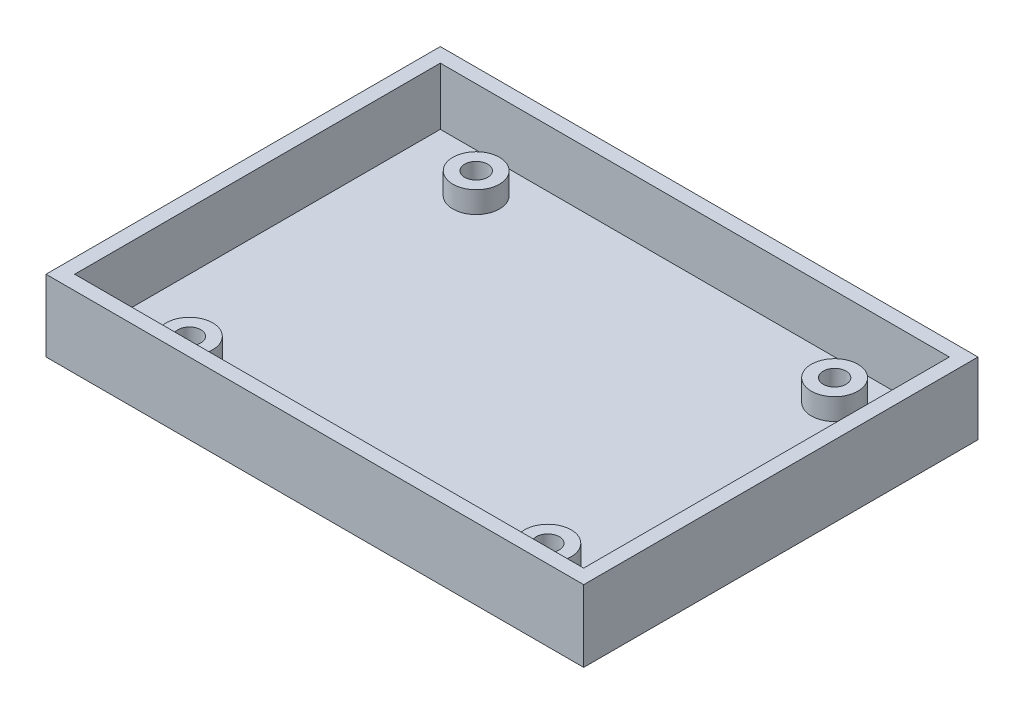
from build123d import *

# Parameters (mm, degrees)
SKETCH1_W             = 75
SKETCH1_H             = 55
BODY_DEPTH            = 10
SHELL1_T              = -2
SKETCH2_R             = 3.25
INSERTS_SUPPORT_DEPTH = 3
SKETCH3_R             = 1.6
INSERTS_HOLES_DEPTH   = 4


with BuildPart() as part:
    # Sketch1 → Body (new body)
    with BuildSketch(Plane(origin=(0, 0, 0), x_dir=(1, 0, 0), z_dir=(0, 1, 0))):
        Rectangle(SKETCH1_W, SKETCH1_H)
    extrude(amount=BODY_DEPTH)

    # Shell1
    shell1_openings = [part.faces().sort_by_distance(p)[0] for p in [
        (0, 10, 0),
    ]]
    offset(amount=SHELL1_T, openings=shell1_openings, kind=Kind.INTERSECTION)

    # Sketch2 → Inserts_Support (add)
    with BuildSketch(Plane(origin=(0, 2, 0), x_dir=(1, 0, 0), z_dir=(0, 1, 0))):
        with Locations(Location((-25, 20, 0), (0, 0, 270))):
            Circle(SKETCH2_R)
        with Locations(Location((25, 20, 0), (0, 0, 270))):
            Circle(SKETCH2_R)
        with Locations(Location((25, -20, 0), (0, 0, 270))):
            Circle(SKETCH2_R)
        with Locations(Location((-25, -20, 0), (0, 0, 270))):
            Circle(SKETCH2_R)
    extrude(amount=INSERTS_SUPPORT_DEPTH)

    # Sketch3 → Inserts_Holes (cut)
    with BuildSketch(Plane(origin=(0, 5, 0), x_dir=(1, 0, 0), z_dir=(0, 1, 0))):
        with Locations(Location((-25, 20, 0), (0, 0, 270))):
            Circle(SKETCH3_R)
        with Locations(Location((25, 20, 0), (0, 0, 270))):
            Circle(SKETCH3_R)
        with Locations(Location((25, -20, 0), (0, 0, 270))):
            Circle(SKETCH3_R)
        with Locations(Location((-25, -20, 0), (0, 0, 270))):
            Circle(SKETCH3_R)
    extrude(amount=-INSERTS_HOLES_DEPTH, mode=Mode.SUBTRACT)


solid = part.part
